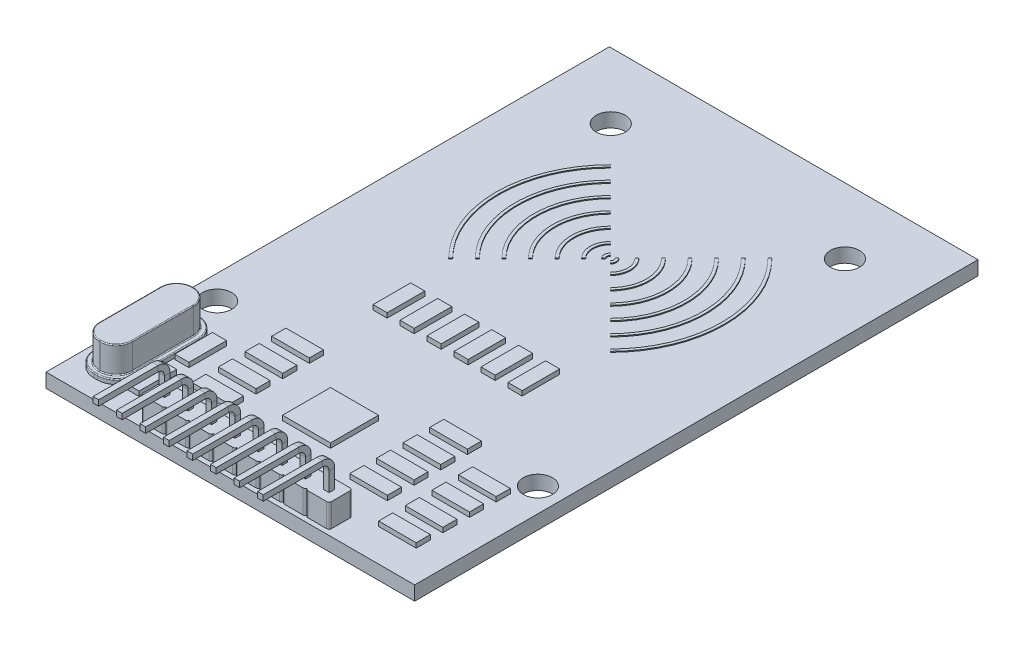
from build123d import *

# Parameters (mm, degrees)
SKETCH1_W                = 39.2
SKETCH1_H                = 59.9
BOSS_EXTRUDE1_DEPTH      = 1.5
SKETCH3_R                = 1.55
CUT_EXTRUDE1_DEPTH       = 1.5
BOSS_EXTRUDE3_DEPTH      = 2.5
SKETCH5_W                = 0.6
SKETCH5_H                = 0.6
CUT_EXTRUDE2_DEPTH       = 4
SKETCH6_W                = 0.6
SKETCH6_H                = 0.6
BOSS_EXTRUDE4_DEPTH      = 0.5
BOSS_EXTRUDE5_DEPTH      = 2.8
FILLET1_R                = 0.1
BOSS_EXTRUDE6_DEPTH      = 0.1
ESBO_O1_W                = 1.5
ESBO_O1_H                = 4
ESBO_O1_W_2              = 4
ESBO_O1_H_2              = 1.5
RESSALTO_EXTRUS_O1_DEPTH = 0.5
ESBO_O2_W                = 5.1
ESBO_O2_H                = 5.1
RESSALTO_EXTRUS_O2_DEPTH = 0.5


with BuildPart() as part:
    # Sketch1 → Boss-Extrude1 (new body)
    with BuildSketch(Plane(origin=(0, 0, 0), x_dir=(1, 0, 0), z_dir=(0, 1, 0))):
        Rectangle(SKETCH1_W, SKETCH1_H)
    extrude(amount=BOSS_EXTRUDE1_DEPTH)

    # Sketch3 → Cut-Extrude1 (cut)
    with BuildSketch(Plane(origin=(0, 1.5, 0), x_dir=(1, 0, 0), z_dir=(0, 1, 0))):
        with Locations(Location((12.45, 22.95, 0), (0, 0, 270))):
            Circle(SKETCH3_R)
        with Locations(Location((-12.45, 22.95, 0), (0, 0, 270))):
            Circle(SKETCH3_R)
        with Locations(Location((17.05, -14.3, 0), (0, 0, 270))):
            Circle(SKETCH3_R)
        with Locations(Location((-17.05, -14.3, 0), (0, 0, 270))):
            Circle(SKETCH3_R)
    extrude(amount=-CUT_EXTRUDE1_DEPTH, mode=Mode.SUBTRACT)

    # Sketch4 → Boss-Extrude3 (add)
    with BuildSketch(Plane(origin=(0, 1.5, 0), x_dir=(1, 0, 0), z_dir=(0, 1, 0))):
        with BuildLine():
            Line((-9.75, -26.95), (-7.75, -26.95))
            ThreePointArc((-7.75, -26.95), (-7.573223305, -27.023223305), (-7.5, -27.2))
            ThreePointArc((-7.5, -27.2), (-7.426776695, -27.023223305), (-7.25, -26.95))
            Line((-7.25, -26.95), (-5.25, -26.95))
            ThreePointArc((-5.25, -26.95), (-5.073223305, -27.023223305), (-5, -27.2))
            ThreePointArc((-5, -27.2), (-4.926776695, -27.023223305), (-4.75, -26.95))
            Line((-4.75, -26.95), (-2.75, -26.95))
            ThreePointArc((-2.75, -26.95), (-2.573223305, -27.023223305), (-2.5, -27.2))
            ThreePointArc((-2.5, -27.2), (-2.426776695, -27.023223305), (-2.25, -26.95))
            Line((-2.25, -26.95), (-0.25, -26.95))
            ThreePointArc((-0.25, -26.95), (-0.073223305, -27.023223305), (0, -27.2))
            ThreePointArc((0, -27.2), (0.073223305, -27.023223305), (0.25, -26.95))
            Line((0.25, -26.95), (2.25, -26.95))
            ThreePointArc((2.25, -26.95), (2.426776695, -27.023223305), (2.5, -27.2))
            ThreePointArc((2.5, -27.2), (2.573223305, -27.023223305), (2.75, -26.95))
            Line((2.75, -26.95), (4.75, -26.95))
            ThreePointArc((4.75, -26.95), (4.926776695, -27.023223305), (5, -27.2))
            ThreePointArc((5, -27.2), (5.073223305, -27.023223305), (5.25, -26.95))
            Line((5.25, -26.95), (7.25, -26.95))
            ThreePointArc((7.25, -26.95), (7.426776695, -27.023223305), (7.5, -27.2))
            ThreePointArc((7.5, -27.2), (7.573223305, -27.023223305), (7.75, -26.95))
            Line((7.75, -26.95), (9.75, -26.95))
            ThreePointArc((9.75, -26.95), (9.926776695, -27.023223305), (10, -27.2))
            Line((10, -27.2), (10, -29.2))
            ThreePointArc((10, -29.2), (9.926776695, -29.376776695), (9.75, -29.45))
            Line((9.75, -29.45), (7.75, -29.45))
            ThreePointArc((7.75, -29.45), (7.573223305, -29.376776695), (7.5, -29.2))
            ThreePointArc((7.5, -29.2), (7.426776695, -29.376776695), (7.25, -29.45))
            Line((7.25, -29.45), (5.25, -29.45))
            ThreePointArc((5.25, -29.45), (5.073223305, -29.376776695), (5, -29.2))
            ThreePointArc((5, -29.2), (4.926776695, -29.376776695), (4.75, -29.45))
            Line((4.75, -29.45), (2.75, -29.45))
            ThreePointArc((2.75, -29.45), (2.573223305, -29.376776695), (2.5, -29.2))
            ThreePointArc((2.5, -29.2), (2.426776695, -29.376776695), (2.25, -29.45))
            Line((2.25, -29.45), (0.25, -29.45))
            ThreePointArc((0.25, -29.45), (0.073223305, -29.376776695), (0, -29.2))
            ThreePointArc((0, -29.2), (-0.073223305, -29.376776695), (-0.25, -29.45))
            Line((-0.25, -29.45), (-2.25, -29.45))
            ThreePointArc((-2.25, -29.45), (-2.426776695, -29.376776695), (-2.5, -29.2))
            ThreePointArc((-2.5, -29.2), (-2.573223305, -29.376776695), (-2.75, -29.45))
            Line((-2.75, -29.45), (-4.75, -29.45))
            ThreePointArc((-4.75, -29.45), (-4.926776695, -29.376776695), (-5, -29.2))
            ThreePointArc((-5, -29.2), (-5.073223305, -29.376776695), (-5.25, -29.45))
            Line((-5.25, -29.45), (-7.25, -29.45))
            ThreePointArc((-7.25, -29.45), (-7.426776695, -29.376776695), (-7.5, -29.2))
            ThreePointArc((-7.5, -29.2), (-7.573223305, -29.376776695), (-7.75, -29.45))
            Line((-7.75, -29.45), (-9.75, -29.45))
            ThreePointArc((-9.75, -29.45), (-9.926776695, -29.376776695), (-10, -29.2))
            Line((-10, -29.2), (-10, -27.2))
            ThreePointArc((-10, -27.2), (-9.926776695, -27.023223305), (-9.75, -26.95))
        make_face()
    extrude(amount=BOSS_EXTRUDE3_DEPTH)

    # Sketch5 → Cut-Extrude2 (cut)
    with BuildSketch(Plane(origin=(0, 4, 0), x_dir=(1, 0, 0), z_dir=(0, 1, 0))):
        with Locations((-8.75, -28.2)):
            Rectangle(SKETCH5_W, SKETCH5_H)
        with Locations((-6.25, -28.2)):
            Rectangle(SKETCH5_W, SKETCH5_H)
        with Locations((-3.75, -28.2)):
            Rectangle(SKETCH5_W, SKETCH5_H)
        with Locations((-1.25, -28.2)):
            Rectangle(SKETCH5_W, SKETCH5_H)
        with Locations((1.25, -28.2)):
            Rectangle(SKETCH5_W, SKETCH5_H)
        with Locations((3.75, -28.2)):
            Rectangle(SKETCH5_W, SKETCH5_H)
        with Locations((6.25, -28.2)):
            Rectangle(SKETCH5_W, SKETCH5_H)
        with Locations((8.75, -28.2)):
            Rectangle(SKETCH5_W, SKETCH5_H)
    extrude(amount=-CUT_EXTRUDE2_DEPTH, mode=Mode.SUBTRACT)

    # Sweep1: sweep along a path in Sketch7
    with BuildLine(Plane.ZY.offset(10)) as sweep1_path:
        Line((28.2, -1), (28.2, 6))
        ThreePointArc((28.2, 6), (28.492893219, 6.707106781), (29.2, 7))
        Line((29.2, 7), (35.5, 7))
    # Sketch6 → Sweep1 (sweep)
    with BuildSketch(Plane(origin=(0, -1, 0), x_dir=(-1, 0, 0), z_dir=(0, -1, 0))):
        with Locations((6.25, -28.2)):
            Rectangle(SKETCH6_W, SKETCH6_H)
        with Locations((8.75, -28.2)):
            Rectangle(SKETCH6_W, SKETCH6_H)
        with Locations((3.75, -28.2)):
            Rectangle(SKETCH6_W, SKETCH6_H)
        with Locations((1.25, -28.2)):
            Rectangle(SKETCH6_W, SKETCH6_H)
        with Locations((-1.25, -28.2)):
            Rectangle(SKETCH6_W, SKETCH6_H)
        with Locations((-3.75, -28.2)):
            Rectangle(SKETCH6_W, SKETCH6_H)
        with Locations((-6.25, -28.2)):
            Rectangle(SKETCH6_W, SKETCH6_H)
        with Locations((-8.75, -28.2)):
            Rectangle(SKETCH6_W, SKETCH6_H)
    sweep(path=sweep1_path.line)

    # Sketch8 → Boss-Extrude4 (add)
    with BuildSketch(Plane(origin=(0, 1.5, 0), x_dir=(1, 0, 0), z_dir=(0, 1, 0))):
        with BuildLine():
            Line((-16.5, -17.15), (-16.15, -17.15))
            ThreePointArc((-16.15, -17.15), (-14.66507576, -17.76507576), (-14.05, -19.25))
            Line((-14.05, -19.25), (-14.05, -25.85))
            ThreePointArc((-14.05, -25.85), (-14.66507576, -27.33492424), (-16.15, -27.95))
            Line((-16.15, -27.95), (-16.5, -27.95))
            ThreePointArc((-16.5, -27.95), (-17.98492424, -27.33492424), (-18.6, -25.85))
            Line((-18.6, -25.85), (-18.6, -19.25))
            ThreePointArc((-18.6, -19.25), (-17.98492424, -17.76507576), (-16.5, -17.15))
        make_face()
    extrude(amount=BOSS_EXTRUDE4_DEPTH)

    # Sketch10 → Boss-Extrude5 (add)
    with BuildSketch(Plane(origin=(0, 2, 0), x_dir=(1, 0, 0), z_dir=(0, 1, 0))):
        with BuildLine():
            Line((-16.375, -17.6), (-16.275, -17.6))
            ThreePointArc((-16.275, -17.6), (-15.072918472, -18.097918472), (-14.575, -19.3))
            Line((-14.575, -19.3), (-14.575, -25.8))
            ThreePointArc((-14.575, -25.8), (-15.072918472, -27.002081528), (-16.275, -27.5))
            Line((-16.275, -27.5), (-16.375, -27.5))
            ThreePointArc((-16.375, -27.5), (-17.577081528, -27.002081528), (-18.075, -25.8))
            Line((-18.075, -25.8), (-18.075, -19.3))
            ThreePointArc((-18.075, -19.3), (-17.577081528, -18.097918472), (-16.375, -17.6))
        make_face()
    extrude(amount=BOSS_EXTRUDE5_DEPTH)

    # Fillet1
    fillet1_edges = [part.edges().sort_by_distance(p)[0] for p in [
        (-17.98492424, 2, 27.33492424),
        (-16.325, 2, 27.95),
        (-14.66507576, 2, 27.33492424),
        (-14.05, 2, 22.55),
        (-14.66507576, 2, 17.76507576),
        (-16.325, 2, 17.15),
        (-17.98492424, 2, 17.76507576),
        (-18.6, 2, 22.55),
        (-17.577081528, 2, 27.002081528),
        (-16.325, 2, 27.5),
        (-15.072918472, 2, 27.002081528),
        (-14.575, 2, 22.55),
        (-15.072918472, 2, 18.097918472),
        (-16.325, 2, 17.6),
        (-17.577081528, 2, 18.097918472),
        (-18.075, 2, 22.55),
        (-17.577081528, 4.8, 27.002081528),
        (-16.325, 4.8, 27.5),
        (-15.072918472, 4.8, 27.002081528),
        (-14.575, 4.8, 22.55),
        (-15.072918472, 4.8, 18.097918472),
        (-16.325, 4.8, 17.6),
        (-17.577081528, 4.8, 18.097918472),
        (-18.075, 4.8, 22.55),
    ]]
    fillet(fillet1_edges, radius=FILLET1_R)

    # Sketch11 → Boss-Extrude6 (add)
    with BuildSketch(Plane(origin=(0, 1.5, 0), x_dir=(1, 0, 0), z_dir=(0, 1, 0))):
        with BuildLine():
            Line((-0.247487373, 10.697487373), (-0.459619408, 10.909619408))
            ThreePointArc((-0.459619408, 10.909619408), (-0.65, 10.45), (-0.459619408, 9.990380592))
            Line((-0.459619408, 9.990380592), (-0.247487373, 10.202512627))
            ThreePointArc((-0.247487373, 10.202512627), (-0.35, 10.45), (-0.247487373, 10.697487373))
        make_face()
        with BuildLine():
            Line((0.247487373, 10.697487373), (0.459619408, 10.909619408))
            ThreePointArc((0.459619408, 10.909619408), (0.65, 10.45), (0.459619408, 9.990380592))
            Line((0.459619408, 9.990380592), (0.247487373, 10.202512627))
            ThreePointArc((0.247487373, 10.202512627), (0.35, 10.45), (0.247487373, 10.697487373))
        make_face()
        with BuildLine():
            Line((-8.485281374, 18.935281374), (-8.591347391, 19.041347391))
            ThreePointArc((-8.591347391, 19.041347391), (-12.15, 10.45), (-8.591347391, 1.858652609))
            Line((-8.591347391, 1.858652609), (-8.485281374, 1.964718626))
            Line((-8.485281374, 1.964718626), (-8.379215357, 2.070784643))
            ThreePointArc((-8.379215357, 2.070784643), (-11.85, 10.45), (-8.379215357, 18.829215357))
            Line((-8.379215357, 18.829215357), (-8.485281374, 18.935281374))
        make_face()
        with BuildLine():
            Line((8.485281374, 1.964718626), (8.591347391, 1.858652609))
            ThreePointArc((8.591347391, 1.858652609), (12.15, 10.45), (8.591347391, 19.041347391))
            Line((8.591347391, 19.041347391), (8.485281374, 18.935281374))
            Line((8.485281374, 18.935281374), (8.379215357, 18.829215357))
            ThreePointArc((8.379215357, 18.829215357), (11.85, 10.45), (8.379215357, 2.070784643))
            Line((8.379215357, 2.070784643), (8.485281374, 1.964718626))
        make_face()
        with BuildLine():
            Line((-6.965001795, 17.415001795), (-7.177133829, 17.627133829))
            ThreePointArc((-7.177133829, 17.627133829), (-10.15, 10.45), (-7.177133829, 3.272866171))
            Line((-7.177133829, 3.272866171), (-6.965001795, 3.484998205))
            ThreePointArc((-6.965001795, 3.484998205), (-9.85, 10.45), (-6.965001795, 17.415001795))
        make_face()
        with BuildLine():
            Line((-5.550788232, 16.000788232), (-5.762920267, 16.212920267))
            ThreePointArc((-5.762920267, 16.212920267), (-8.15, 10.45), (-5.762920267, 4.687079733))
            Line((-5.762920267, 4.687079733), (-5.550788232, 4.899211768))
            ThreePointArc((-5.550788232, 4.899211768), (-7.85, 10.45), (-5.550788232, 16.000788232))
        make_face()
        with BuildLine():
            Line((-4.13657467, 14.58657467), (-4.348706704, 14.798706704))
            ThreePointArc((-4.348706704, 14.798706704), (-6.15, 10.45), (-4.348706704, 6.101293296))
            Line((-4.348706704, 6.101293296), (-4.13657467, 6.31342533))
            ThreePointArc((-4.13657467, 6.31342533), (-5.85, 10.45), (-4.13657467, 14.58657467))
        make_face()
        with BuildLine():
            Line((-2.722361108, 13.172361108), (-2.934493142, 13.384493142))
            ThreePointArc((-2.934493142, 13.384493142), (-4.15, 10.45), (-2.934493142, 7.515506858))
            Line((-2.934493142, 7.515506858), (-2.722361108, 7.727638892))
            ThreePointArc((-2.722361108, 7.727638892), (-3.85, 10.45), (-2.722361108, 13.172361108))
        make_face()
        with BuildLine():
            Line((-1.308147545, 11.758147545), (-1.52027958, 11.97027958))
            ThreePointArc((-1.52027958, 11.97027958), (-2.15, 10.45), (-1.52027958, 8.92972042))
            Line((-1.52027958, 8.92972042), (-1.308147545, 9.141852455))
            ThreePointArc((-1.308147545, 9.141852455), (-1.85, 10.45), (-1.308147545, 11.758147545))
        make_face()
        with BuildLine():
            Line((1.308147545, 9.141852455), (1.52027958, 8.92972042))
            ThreePointArc((1.52027958, 8.92972042), (2.15, 10.45), (1.52027958, 11.97027958))
            Line((1.52027958, 11.97027958), (1.308147545, 11.758147545))
            ThreePointArc((1.308147545, 11.758147545), (1.85, 10.45), (1.308147545, 9.141852455))
        make_face()
        with BuildLine():
            Line((2.722361108, 7.727638892), (2.934493142, 7.515506858))
            ThreePointArc((2.934493142, 7.515506858), (4.15, 10.45), (2.934493142, 13.384493142))
            Line((2.934493142, 13.384493142), (2.722361108, 13.172361108))
            ThreePointArc((2.722361108, 13.172361108), (3.85, 10.45), (2.722361108, 7.727638892))
        make_face()
        with BuildLine():
            Line((4.13657467, 6.31342533), (4.348706704, 6.101293296))
            ThreePointArc((4.348706704, 6.101293296), (6.15, 10.45), (4.348706704, 14.798706704))
            Line((4.348706704, 14.798706704), (4.13657467, 14.58657467))
            ThreePointArc((4.13657467, 14.58657467), (5.85, 10.45), (4.13657467, 6.31342533))
        make_face()
        with BuildLine():
            Line((5.550788232, 4.899211768), (5.762920267, 4.687079733))
            ThreePointArc((5.762920267, 4.687079733), (8.15, 10.45), (5.762920267, 16.212920267))
            Line((5.762920267, 16.212920267), (5.550788232, 16.000788232))
            ThreePointArc((5.550788232, 16.000788232), (7.85, 10.45), (5.550788232, 4.899211768))
        make_face()
        with BuildLine():
            Line((6.965001795, 3.484998205), (7.177133829, 3.272866171))
            ThreePointArc((7.177133829, 3.272866171), (10.15, 10.45), (7.177133829, 17.627133829))
            Line((7.177133829, 17.627133829), (6.965001795, 17.415001795))
            ThreePointArc((6.965001795, 17.415001795), (9.85, 10.45), (6.965001795, 3.484998205))
        make_face()
    extrude(amount=BOSS_EXTRUDE6_DEPTH)

    # Esboço1 → Ressalto-extrusão1 (add)
    with BuildSketch(Plane(origin=(0, 1.5, 0), x_dir=(1, 0, 0), z_dir=(0, 1, 0))):
        with Locations((7.175, -4.85)):
            Rectangle(ESBO_O1_W, ESBO_O1_H)
        with Locations((4.305, -4.85)):
            Rectangle(ESBO_O1_W, ESBO_O1_H)
        with Locations((1.435, -4.85)):
            Rectangle(ESBO_O1_W, ESBO_O1_H)
        with Locations((-1.435, -4.85)):
            Rectangle(ESBO_O1_W, ESBO_O1_H)
        with Locations((-4.305, -4.85)):
            Rectangle(ESBO_O1_W, ESBO_O1_H)
        with Locations((-7.175, -4.85)):
            Rectangle(ESBO_O1_W, ESBO_O1_H)
        with Locations((-8.4, -22.9)):
            Rectangle(ESBO_O1_W_2, ESBO_O1_H_2)
        with Locations((-8.4, -20.066666667)):
            Rectangle(ESBO_O1_W_2, ESBO_O1_H_2)
        with Locations((-8.4, -17.233333333)):
            Rectangle(ESBO_O1_W_2, ESBO_O1_H_2)
        with Locations((-8.4, -14.4)):
            Rectangle(ESBO_O1_W_2, ESBO_O1_H_2)
        with Locations((8.4, -14.4)):
            Rectangle(ESBO_O1_W_2, ESBO_O1_H_2)
        with Locations((8.4, -17.233333333)):
            Rectangle(ESBO_O1_W_2, ESBO_O1_H_2)
        with Locations((8.4, -20.066666667)):
            Rectangle(ESBO_O1_W_2, ESBO_O1_H_2)
        with Locations((8.4, -22.9)):
            Rectangle(ESBO_O1_W_2, ESBO_O1_H_2)
        with Locations((-13.15, -19.95)):
            Rectangle(ESBO_O1_W, ESBO_O1_H)
        with Locations((-13.15, -25.25)):
            Rectangle(ESBO_O1_W, ESBO_O1_H)
        with Locations((14.3, -17.233333333)):
            Rectangle(ESBO_O1_W_2, ESBO_O1_H_2)
        with Locations((14.3, -20.066666667)):
            Rectangle(ESBO_O1_W_2, ESBO_O1_H_2)
        with Locations((14.3, -22.9)):
            Rectangle(ESBO_O1_W_2, ESBO_O1_H_2)
        with Locations((14.3, -25.733333333)):
            Rectangle(ESBO_O1_W_2, ESBO_O1_H_2)
    extrude(amount=RESSALTO_EXTRUS_O1_DEPTH)

    # Esboço2 → Ressalto-extrusão2 (add)
    with BuildSketch(Plane(origin=(0, 1.5, 0), x_dir=(1, 0, 0), z_dir=(0, 1, 0))):
        with Locations((0, -19.3)):
            Rectangle(ESBO_O2_W, ESBO_O2_H)
    extrude(amount=RESSALTO_EXTRUS_O2_DEPTH)


solid = part.part
